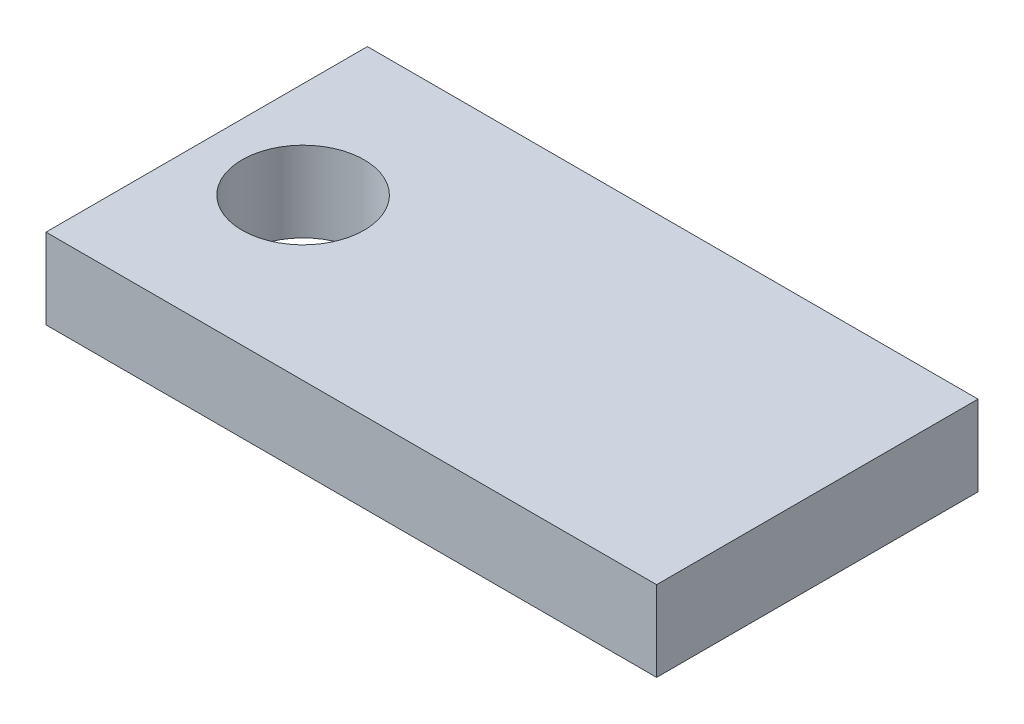
from build123d import *

# Parameters (mm, degrees)
SKETCH1_W           = 48.26
SKETCH1_H           = 25.4
BOSS_EXTRUDE1_DEPTH = 6.35
SKETCH2_R           = 4.826
CUT_EXTRUDE1_DEPTH  = 8.89


with BuildPart() as part:
    # Sketch1 → Boss-Extrude1 (new body)
    with BuildSketch(Plane(origin=(0, 0, 0), x_dir=(1, 0, 0), z_dir=(0, 1, 0))):
        Rectangle(SKETCH1_W, SKETCH1_H)
    extrude(amount=BOSS_EXTRUDE1_DEPTH)

    # Sketch2 → Cut-Extrude1 (cut)
    with BuildSketch(Plane(origin=(0, 6.35, 0), x_dir=(1, 0, 0), z_dir=(0, 1, 0))):
        with Locations(Location((-16.51, 0, 0), (0, 0, 270))):
            Circle(SKETCH2_R)
    extrude(amount=-CUT_EXTRUDE1_DEPTH, mode=Mode.SUBTRACT)


solid = part.part
